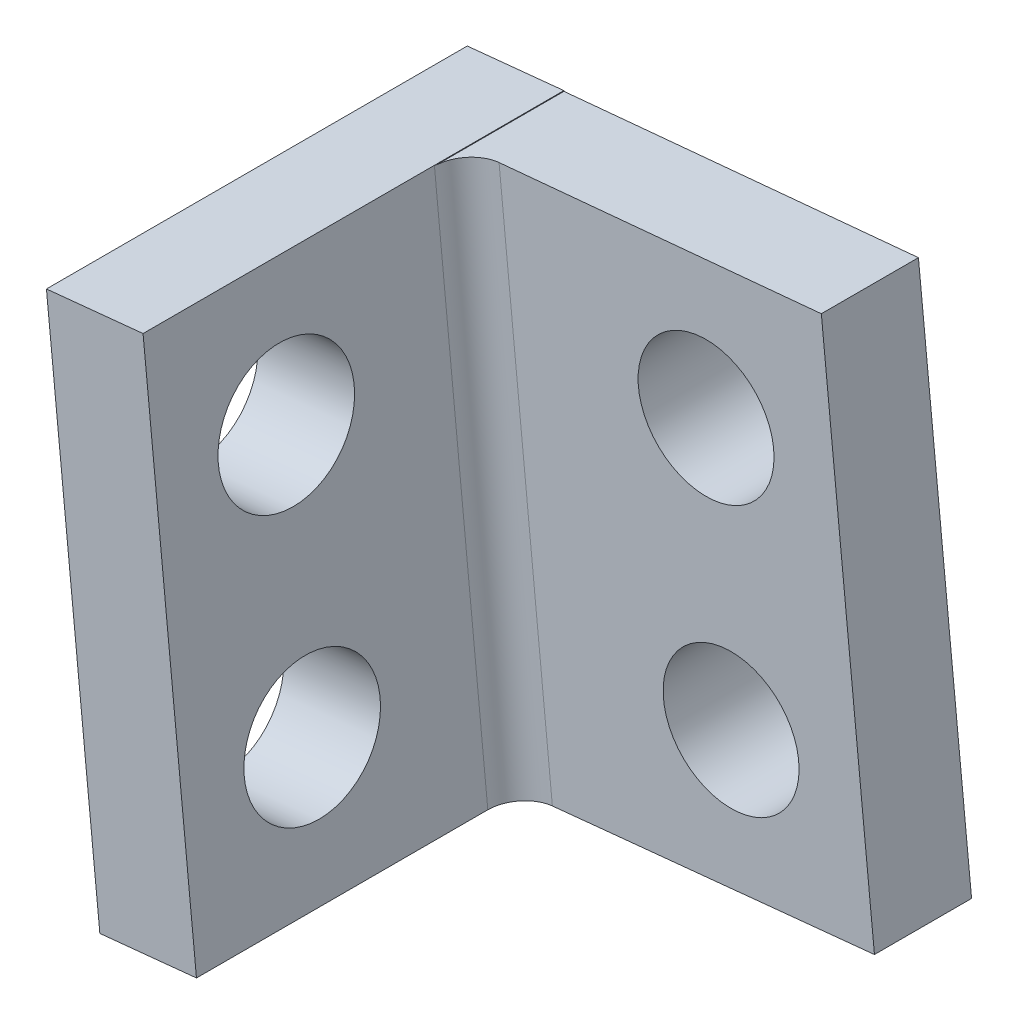
from build123d import *

# Parameters (mm, degrees)
SKETCH1_R           = 2.1
BOSS_EXTRUDE1_DEPTH = 3
SKETCH3_W           = 13
SKETCH3_H           = 16.5
SKETCH3_R           = 2.1
BOSS_EXTRUDE2_DEPTH = 3
FILLET1_R           = 1


with BuildPart() as part:
    # Sketch1 → Boss-Extrude1 (new body)
    with BuildSketch(Plane.XY):
        Polygon((-105, 44.736808962), (-103.35, 28.31951625), (-89.420175881, 29.71951625), (-91.061152102, 46.043912356), align=None)
        with Locations((-94.622025059, 41.474945451)):
            Circle(SKETCH1_R, mode=Mode.SUBTRACT)
        with Locations((-93.848562649, 33.512423495)):
            Circle(SKETCH1_R, mode=Mode.SUBTRACT)
    extrude(amount=BOSS_EXTRUDE1_DEPTH)

    # Sketch3 → Boss-Extrude2 (add)
    with BuildSketch(Plane(origin=(-99.498743711, -10, 0), x_dir=(0, 0, 1), z_dir=(-0.9949874371066202, -0.09999999999999917, 0))):
        with Locations((6.5, 46.762562893)):
            Rectangle(SKETCH3_W, SKETCH3_H)
        with Locations(Location((9, 42.762562893, 0), (0, 0, 270))):
            Circle(SKETCH3_R, mode=Mode.SUBTRACT)
        with Locations(Location((9, 50.762562893, 0), (0, 0, 270))):
            Circle(SKETCH3_R, mode=Mode.SUBTRACT)
    extrude(amount=-BOSS_EXTRUDE2_DEPTH)

    # Fillet1
    fillet1_edges = [part.edges().sort_by_distance(p)[0] for p in [
        (-101.189037666, 36.81821251, 3),
    ]]
    fillet(fillet1_edges, radius=FILLET1_R)


solid = part.part
